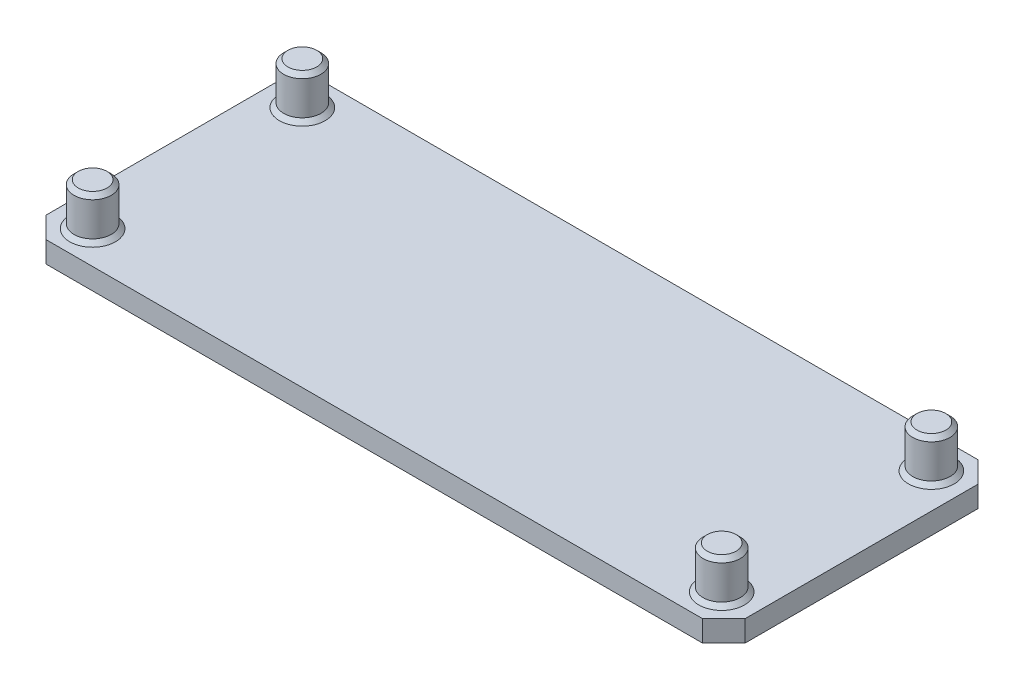
from build123d import *

# Parameters (mm, degrees)
SKETCH2_W           = 165
SKETCH2_H           = 65
BOSS_EXTRUDE1_DEPTH = 5
SKETCH3_R           = 4.4
BOSS_EXTRUDE2_DEPTH = 10
CHAMFER1_SIZE       = 1
CHAMFER2_SIZE       = 5
SKETCH4_R           = 1
CUT_EXTRUDE1_DEPTH  = 2
SKETCH5_R           = 10.25
SKETCH5_R_2         = 11.25
SKETCH5_R_3         = 5.75
CUT_EXTRUDE2_DEPTH  = 2


with BuildPart() as part:
    # Sketch2 → Boss-Extrude1 (new body)
    with BuildSketch(Plane(origin=(0, 0, 0), x_dir=(1, 0, 0), z_dir=(0, 1, 0))):
        Rectangle(SKETCH2_W, SKETCH2_H)
    extrude(amount=BOSS_EXTRUDE1_DEPTH)

    # Sketch3 → Boss-Extrude2 (add)
    with BuildSketch(Plane(origin=(0, 5, 0), x_dir=(1, 0, 0), z_dir=(0, 1, 0))):
        with Locations(Location((-74.245, 24.75, 0), (0, 0, 90))):
            Circle(SKETCH3_R)
        with Locations(Location((-74.245, -24.75, 0), (0, 0, 90))):
            Circle(SKETCH3_R)
        with Locations(Location((74.245, -24.75, 0), (0, 0, 90))):
            Circle(SKETCH3_R)
        with Locations(Location((74.245, 24.75, 0), (0, 0, 90))):
            Circle(SKETCH3_R)
    extrude(amount=BOSS_EXTRUDE2_DEPTH)

    # Chamfer1
    chamfer1_edges = [part.edges().sort_by_distance(p)[0] for p in [
        (-74.245, 5, -20.35),
        (-74.245, 15, -20.35),
        (-74.245, 5, 29.15),
        (-74.245, 15, 29.15),
        (74.245, 5, 29.15),
        (74.245, 15, 29.15),
        (74.245, 5, -20.35),
        (74.245, 15, -20.35),
    ]]
    chamfer(chamfer1_edges, length=CHAMFER1_SIZE)

    # Chamfer2
    chamfer2_edges = [part.edges().sort_by_distance(p)[0] for p in [
        (82.5, 2.5, 32.5),
        (-82.5, 2.5, 32.5),
        (-82.5, 2.5, -32.5),
        (82.5, 2.5, -32.5),
    ]]
    chamfer(chamfer2_edges, length=CHAMFER2_SIZE)

    # Sketch4 → Cut-Extrude1 (cut)
    with BuildSketch(Plane.XZ):
        with Locations(Location((-77.5, 27.5, 0), (0, 0, 270))):
            Circle(SKETCH4_R)
        with Locations(Location((-77.5, -27.5, 0), (0, 0, 270))):
            Circle(SKETCH4_R)
        with Locations(Location((77.5, -27.5, 0), (0, 0, 270))):
            Circle(SKETCH4_R)
    extrude(amount=-CUT_EXTRUDE1_DEPTH, mode=Mode.SUBTRACT)

    # Sketch5 → Cut-Extrude2 (cut)
    with BuildSketch(Plane.XZ):
        with Locations(Location((-25.75, 0, 0), (0, 0, 270))):
            Circle(SKETCH5_R)
        with Locations(Location((34.25, 0, 0), (0, 0, 270))):
            Circle(SKETCH5_R_2)
        with Locations(Location((59.25, 0, 0), (0, 0, 270))):
            Circle(SKETCH5_R_3)
        Polygon((-59.25, 17.60918321), (-74.5, 8.804591605), (-74.5, -8.804591605), (-59.25, -17.60918321), (-44, -8.804591605), (-44, 8.804591605), align=None)
        Polygon((15, -6.495190528), (15, 6.495190528), (3.75, 12.990381057), (-7.5, 6.495190528), (-7.5, -6.495190528), (3.75, -12.990381057), align=None)
    extrude(amount=-CUT_EXTRUDE2_DEPTH, mode=Mode.SUBTRACT)


solid = part.part
